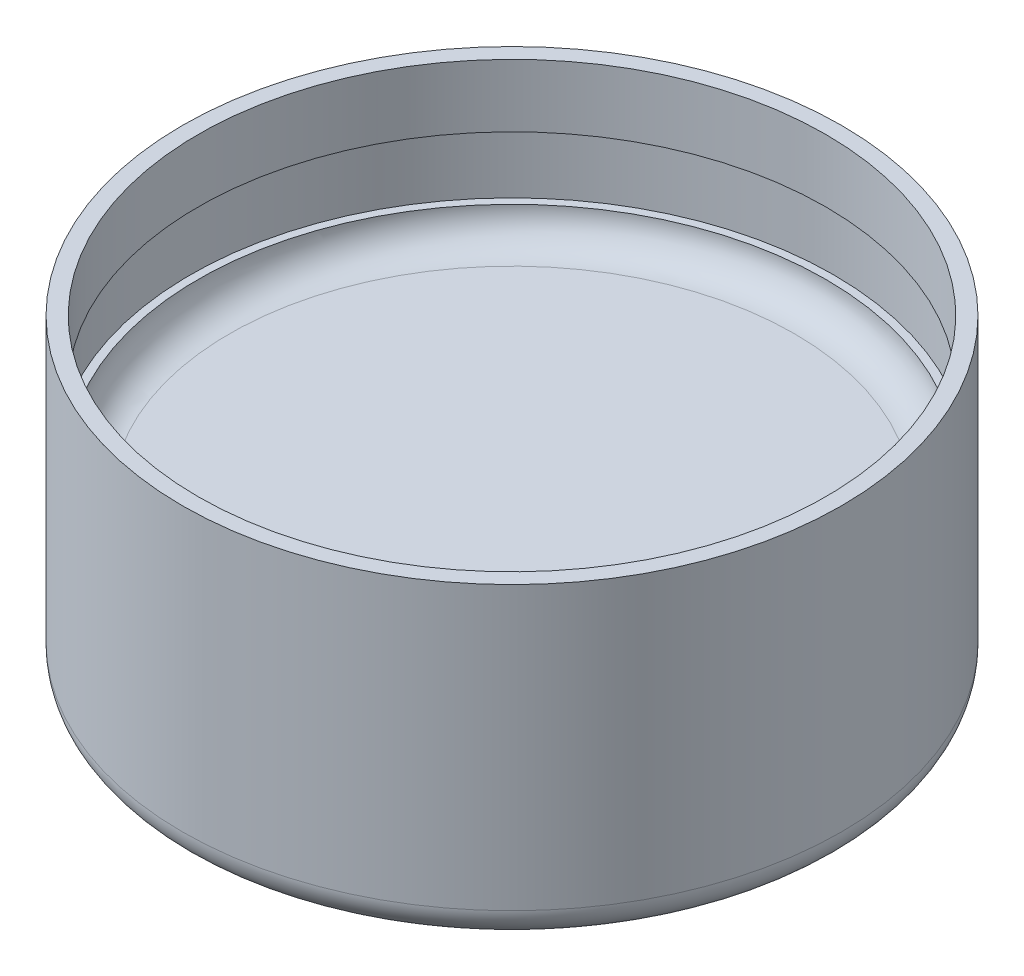
from build123d import *

# Parameters (mm, degrees)
SKETCH1_R           = 105
BOSS_EXTRUDE2_DEPTH = 100
SKETCH2_R           = 100
CUT_EXTRUDE2_DEPTH  = 50
FILLET1_R           = 10
FILLET2_R           = 10


with BuildPart() as part:
    # Sketch1 → Boss-Extrude2 (new body)
    with BuildSketch(Plane(origin=(0, 0, 0), x_dir=(1, 0, 0), z_dir=(0, 1, 0))):
        with Locations(Location((0, 0, 0), (0, 0, 270))):
            Circle(SKETCH1_R)
    extrude(amount=BOSS_EXTRUDE2_DEPTH)

    # Sketch2 → Cut-Extrude2 (cut)
    with BuildSketch(Plane(origin=(0, 100, 0), x_dir=(1, 0, 0), z_dir=(0, 1, 0))):
        with Locations(Location((0, 0, 0), (0, 0, 270))):
            Circle(SKETCH2_R)
    extrude(amount=-CUT_EXTRUDE2_DEPTH, mode=Mode.SUBTRACT)

    # Fillet1
    fillet1_edges = [part.edges().sort_by_distance(p)[0] for p in [
        (0, 50, -100),
    ]]
    fillet(fillet1_edges, radius=FILLET1_R)

    # Fillet2
    fillet2_edges = [part.edges().sort_by_distance(p)[0] for p in [
        (0, 0, -105),
    ]]
    fillet(fillet2_edges, radius=FILLET2_R)

    # Sketch4 → Cut-Revolve1 (revolve, cut)
    with BuildSketch(Plane.XY, mode=Mode.PRIVATE) as cut_revolve1_sk:
        Polygon((0, 80), (0, 63), (0, 60), (102.5, 60), (102.5, 80), align=None)
    revolve(cut_revolve1_sk.sketch.rotate(Axis((0, 0, 0), (0, 1, 0)), 270), axis=Axis((0, 0, 0), (0, 1, 0)), mode=Mode.SUBTRACT)


solid = part.part
